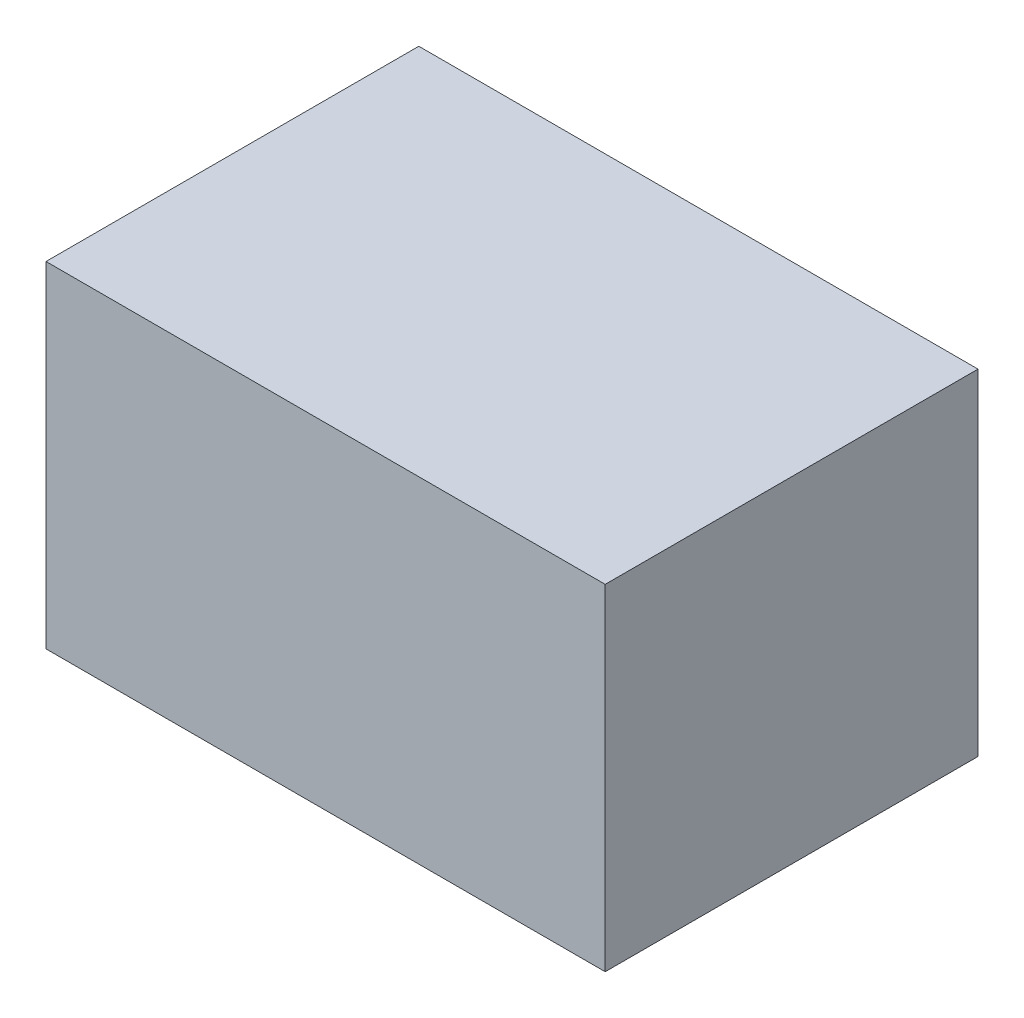
from build123d import *

# Parameters (mm, degrees)
SKETCH1_W           = 30
SKETCH1_H           = 20
BOSS_EXTRUDE1_DEPTH = 18


with BuildPart() as part:
    # Sketch1 → Boss-Extrude1 (new body)
    with BuildSketch(Plane(origin=(0, 0, 0), x_dir=(1, 0, 0), z_dir=(0, 1, 0))):
        with Locations((15, 10)):
            Rectangle(SKETCH1_W, SKETCH1_H)
    extrude(amount=BOSS_EXTRUDE1_DEPTH)


solid = part.part
